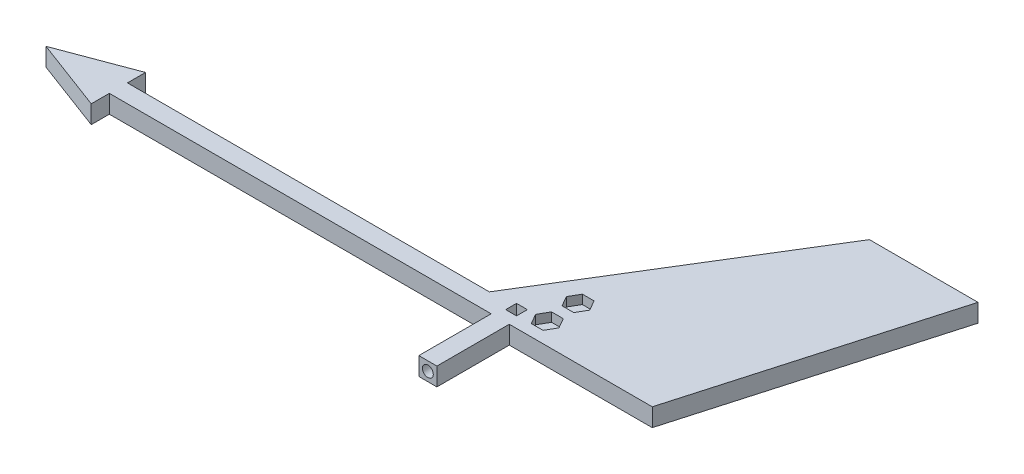
from build123d import *

# Parameters (mm, degrees)
BOSS_EXTRUDE1_DEPTH = 2.5
CUT_EXTRUDE2_DEPTH  = 2.5
SKETCH3_W           = 5
SKETCH3_H           = 5
BOSS_EXTRUDE2_DEPTH = 20
SKETCH4_R           = 1.5
CUT_EXTRUDE3_DEPTH  = 23
SKETCH6_W           = 3
SKETCH6_H           = 3
CUT_EXTRUDE5_DEPTH  = 4


with BuildPart() as part:
    # Sketch1 → Boss-Extrude1 (new, symmetric)
    with BuildSketch(Plane(origin=(0, 0, 0), x_dir=(1, 0, 0), z_dir=(0, 1, 0))):
        Polygon((-20, 0), (0, 7.5), (0, 2.5), (100, 2.5), (140, 67.5), (170, 67.5), (150, -2.5), (0, -2.5), (0, -7.5), align=None)
    extrude(amount=BOSS_EXTRUDE1_DEPTH, both=True)

    # Sketch2 → Cut-Extrude2 (cut)
    with BuildSketch(Plane(origin=(0, 2.5, 0), x_dir=(1, 0, 0), z_dir=(0, 1, 0))):
        Polygon((118.233161507, 12), (116.616580754, 14.8), (113.383419246, 14.8), (111.766838493, 12), (113.383419246, 9.2), (116.616580754, 9.2), align=None)
        Polygon((118.233161507, 3.5), (116.616580754, 6.3), (113.383419246, 6.3), (111.766838493, 3.5), (113.383419246, 0.7), (116.616580754, 0.7), align=None)
    extrude(amount=-CUT_EXTRUDE2_DEPTH, mode=Mode.SUBTRACT)

    # Sketch3 → Boss-Extrude2 (add)
    with BuildSketch(Plane.XY.offset(2.5)):
        with Locations((108, 0)):
            Rectangle(SKETCH3_W, SKETCH3_H)
    extrude(amount=BOSS_EXTRUDE2_DEPTH)

    # Sketch4 → Cut-Extrude3 (cut)
    with BuildSketch(Plane.XY.offset(22.5)):
        with Locations((108, 0)):
            Circle(SKETCH4_R)
    extrude(amount=-CUT_EXTRUDE3_DEPTH, mode=Mode.SUBTRACT)

    # Sketch6 → Cut-Extrude5 (cut)
    with BuildSketch(Plane(origin=(0, 2.5, 0), x_dir=(1, 0, 0), z_dir=(0, 1, 0))):
        with Locations((108, 2)):
            Rectangle(SKETCH6_W, SKETCH6_H)
    extrude(amount=-CUT_EXTRUDE5_DEPTH, mode=Mode.SUBTRACT)


solid = part.part
